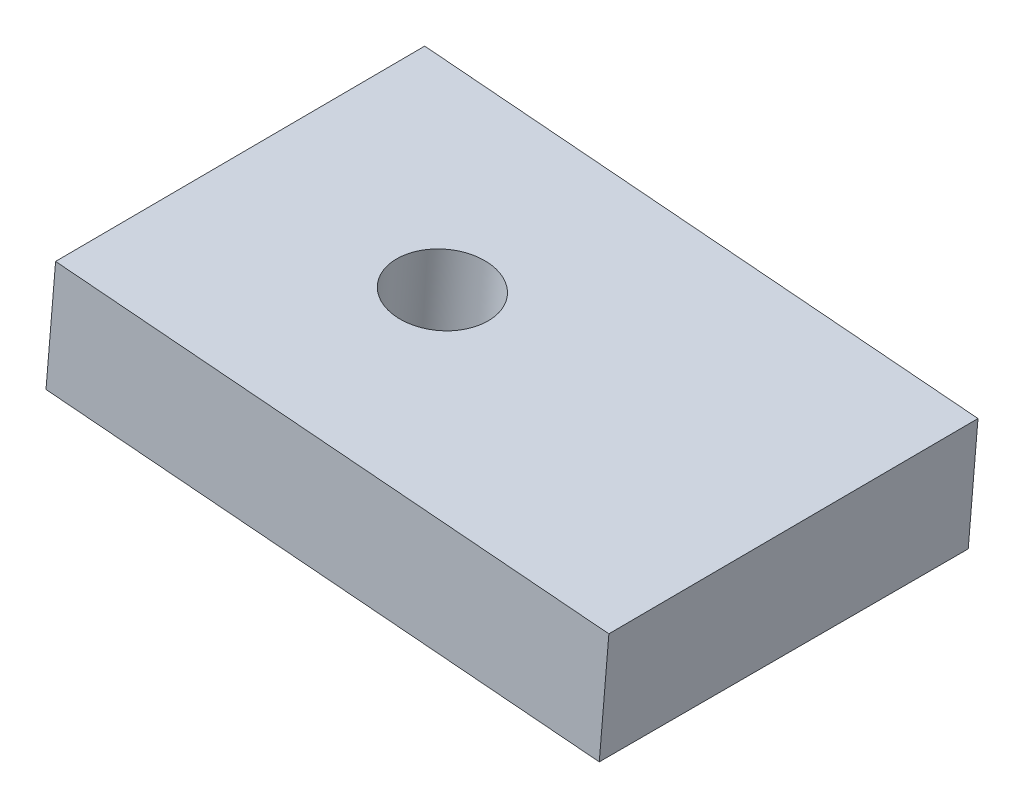
from build123d import *

# Parameters (mm, degrees)
SKETCH1_W                 = 15.047570974
SKETCH1_H                 = 10
BOSS_EXTRUDE1_DEPTH       = 3.203817716
DRAFT1_ANGLE              = -0.325763712
F_2_CLEARANCE_HOLE1_D     = 2.5
F_2_CLEARANCE_HOLE1_DEPTH = 4.421800182


with BuildPart() as part:
    # Sketch1 → Boss-Extrude1 (new body)
    with BuildSketch(Plane(origin=(-1.315367261, -15.86205167, 0), x_dir=(0.9965793195216839, -0.08264175640496577, 0), z_dir=(-0.08264175640496577, -0.9965793195216839, 0))):
        with Locations((-16.701480395, 5)):
            Rectangle(SKETCH1_W, SKETCH1_H)
    extrude(amount=-BOSS_EXTRUDE1_DEPTH)

    # Draft1
    draft1_faces = [part.faces().sort_by_distance(p)[0] for p in [
        (-17.694948105, -11.288953517, 5),
    ]]
    draft(draft1_faces, Plane(origin=(-25.192997126, -10.66717467, 0), x_dir=(-1, 0, 0), z_dir=(0, 0, -1)), DRAFT1_ANGLE)

    # #2 Clearance Hole1
    with Locations(Plane(origin=(-1.052360177, -12.690441673, 0), x_dir=(0.9965793195216839, -0.08264175640496575, 0), z_dir=(0.08264175640496575, 0.9965793195216839, 0))):
        with Locations((-18.725265882, -5)):
            Hole(F_2_CLEARANCE_HOLE1_D / 2, depth=F_2_CLEARANCE_HOLE1_DEPTH)


solid = part.part
